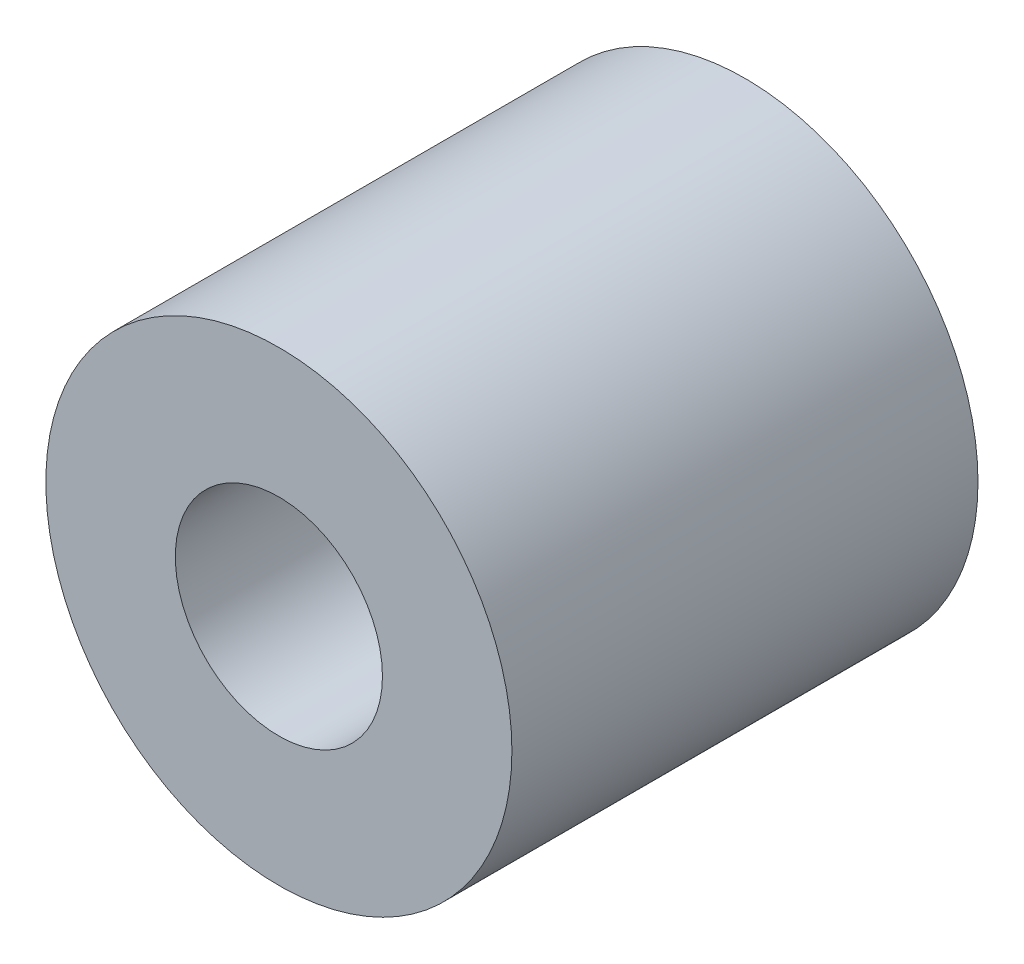
from build123d import *

# Parameters (mm, degrees)
SKIZZE1_R                       = 4.5
SKIZZE1_R_2                     = 2
AUFSATZ_LINEAR_AUSTRAGEN1_DEPTH = 9


with BuildPart() as part:
    # Skizze1 → Aufsatz-Linear austragen1 (new body)
    with BuildSketch(Plane.XY):
        Circle(SKIZZE1_R)
        Circle(SKIZZE1_R_2, mode=Mode.SUBTRACT)
    extrude(amount=AUFSATZ_LINEAR_AUSTRAGEN1_DEPTH)


solid = part.part
